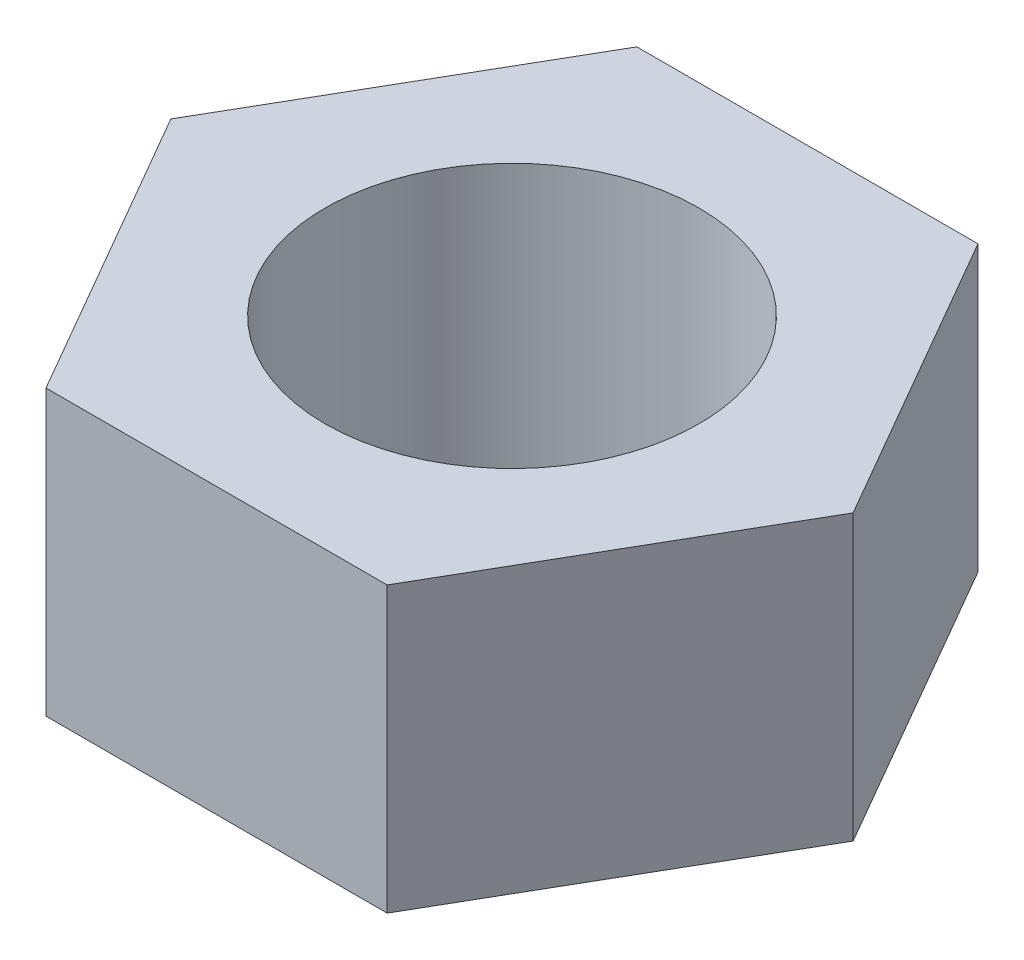
from build123d import *

# Parameters (mm, degrees)
SKETCH_1_R      = 2.5
EXTRUDE_1_DEPTH = 3.8


with BuildPart() as part:
    # Эскиз1 → Бобышка-Вытянуть1 (new body)
    with BuildSketch(Plane(origin=(0, 0, 0), x_dir=(1, 0, 0), z_dir=(0, 1, 0))):
        Polygon((2.280533563, -3.95), (4.561067127, 0), (2.280533563, 3.95), (-2.280533563, 3.95), (-4.561067127, 0), (-2.280533563, -3.95), align=None)
        with Locations(Location((0, 0, 0), (0, 0, 90))):
            Circle(SKETCH_1_R, mode=Mode.SUBTRACT)
    extrude(amount=EXTRUDE_1_DEPTH)


solid = part.part
